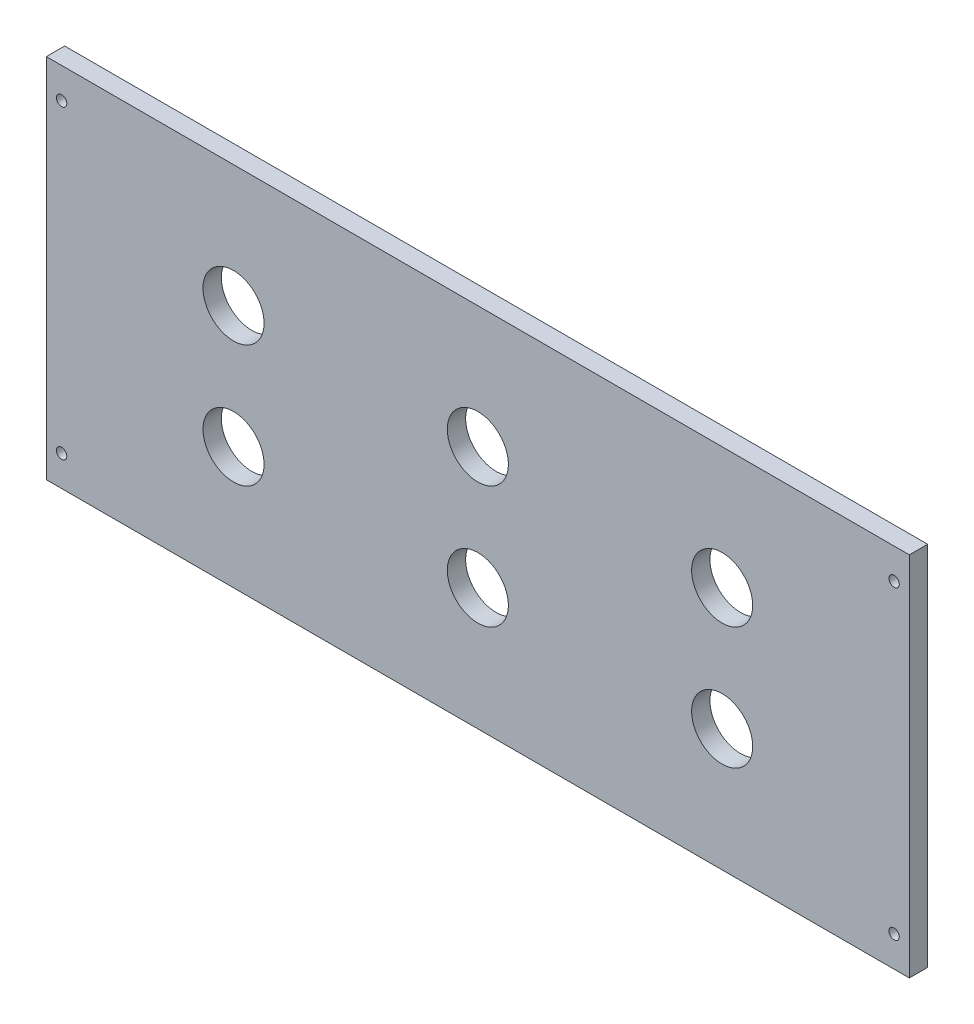
from build123d import *

# Parameters (mm, degrees)
SKETCH1_W           = 141.3
SKETCH1_H           = 60
SKETCH1_R           = 0.85
SKETCH1_R_2         = 5
BOSS_EXTRUDE1_DEPTH = 3


with BuildPart() as part:
    # Sketch1 → Boss-Extrude1 (new body)
    with BuildSketch(Plane.XY):
        Rectangle(SKETCH1_W, SKETCH1_H)
        with Locations((-68.15, 25)):
            Circle(SKETCH1_R, mode=Mode.SUBTRACT)
        with Locations(Location((-68.15, -25, 0), (0, 0, 180))):
            Circle(SKETCH1_R, mode=Mode.SUBTRACT)
        with Locations((68.15, -25)):
            Circle(SKETCH1_R, mode=Mode.SUBTRACT)
        with Locations(Location((68.15, 25, 0), (0, 0, 180))):
            Circle(SKETCH1_R, mode=Mode.SUBTRACT)
        with Locations((0, -10)):
            Circle(SKETCH1_R_2, mode=Mode.SUBTRACT)
        with Locations((-40, -10)):
            Circle(SKETCH1_R_2, mode=Mode.SUBTRACT)
        with Locations(Location((40, -10, 0), (0, 0, 180))):
            Circle(SKETCH1_R_2, mode=Mode.SUBTRACT)
        with Locations((40, 10)):
            Circle(SKETCH1_R_2, mode=Mode.SUBTRACT)
        with Locations(Location((0, 10, 0), (0, 0, 180))):
            Circle(SKETCH1_R_2, mode=Mode.SUBTRACT)
        with Locations(Location((-40, 10, 0), (0, 0, 180))):
            Circle(SKETCH1_R_2, mode=Mode.SUBTRACT)
    extrude(amount=BOSS_EXTRUDE1_DEPTH)


solid = part.part
